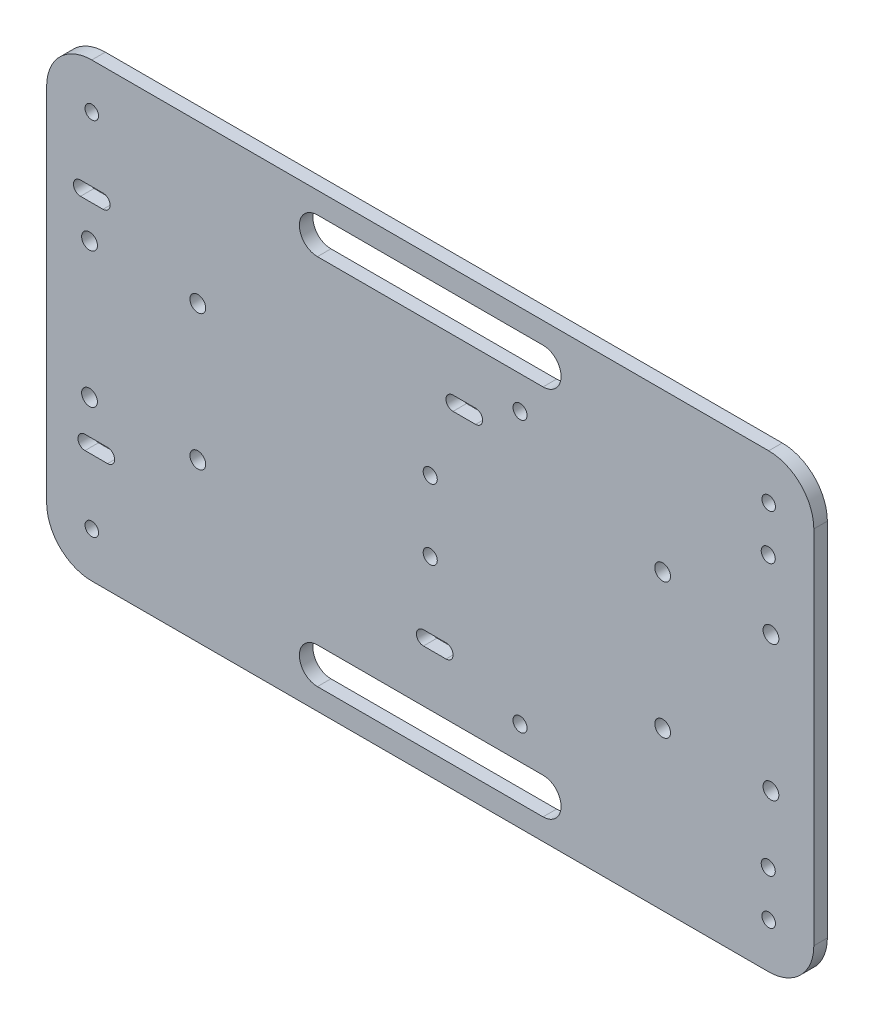
from build123d import *

# Parameters (mm, degrees)
SKETCH1_R           = 1.5
SKETCH1_R_2         = 1.75
SKETCH1_R_3         = 1.56
BOSS_EXTRUDE1_DEPTH = 3


with BuildPart() as part:
    # Sketch1 → Boss-Extrude1 (new body)
    with BuildSketch(Plane.XY):
        with BuildLine():
            Line((75, 50), (-75, 50))
            ThreePointArc((-75, 50), (-82.071067812, 47.071067812), (-85, 40))
            Line((-85, 40), (-85, -40))
            ThreePointArc((-85, -40), (-82.071067812, -47.071067812), (-75, -50))
            Line((-75, -50), (75, -50))
            ThreePointArc((75, -50), (82.071067812, -47.071067812), (85, -40))
            Line((85, -40), (85, -20))
            Line((85, -20), (85, 20))
            Line((85, 20), (85, 40))
            ThreePointArc((85, 40), (82.071067812, 47.071067812), (75, 50))
        make_face()
        with Locations((-75, -40)):
            Circle(SKETCH1_R, mode=Mode.SUBTRACT)
        with BuildLine():
            ThreePointArc((-71.5, -22.59), (-69.94, -24.15), (-71.5, -25.71))
            Line((-71.5, -25.71), (-74, -25.71))
            Line((-74, -25.71), (-76.5, -25.71))
            ThreePointArc((-76.5, -25.71), (-78.06, -24.15), (-76.5, -22.59))
            Line((-76.5, -22.59), (-74, -22.59))
            Line((-74, -22.59), (-71.5, -22.59))
        make_face(mode=Mode.SUBTRACT)
        with Locations((-75.5, -15)):
            Circle(SKETCH1_R_2, mode=Mode.SUBTRACT)
        with Locations((-51.5, -15)):
            Circle(SKETCH1_R_2, mode=Mode.SUBTRACT)
        with BuildLine():
            Line((25, -45.257829906), (-25, -45.257829906))
            ThreePointArc((-25, -45.257829906), (-29, -41.257829906), (-25, -37.257829906))
            Line((-25, -37.257829906), (25, -37.257829906))
            ThreePointArc((25, -37.257829906), (29, -41.257829906), (25, -45.257829906))
        make_face(mode=Mode.SUBTRACT)
        with Locations((19.9, -30)):
            Circle(SKETCH1_R_3, mode=Mode.SUBTRACT)
        with Locations((75, -40)):
            Circle(SKETCH1_R, mode=Mode.SUBTRACT)
        with Locations((74.9, -30)):
            Circle(SKETCH1_R_3, mode=Mode.SUBTRACT)
        with BuildLine():
            ThreePointArc((3.5, -22.59), (5.06, -24.15), (3.5, -25.71))
            Line((3.5, -25.71), (1, -25.71))
            Line((1, -25.71), (-1.5, -25.71))
            ThreePointArc((-1.5, -25.71), (-3.06, -24.15), (-1.5, -22.59))
            Line((-1.5, -22.59), (1, -22.59))
            Line((1, -22.59), (3.5, -22.59))
        make_face(mode=Mode.SUBTRACT)
        with Locations((0, -7.78)):
            Circle(SKETCH1_R_3, mode=Mode.SUBTRACT)
        with Locations((51.5, -15)):
            Circle(SKETCH1_R_2, mode=Mode.SUBTRACT)
        with Locations((75.5, -15)):
            Circle(SKETCH1_R_2, mode=Mode.SUBTRACT)
        with Locations((-75.5, 15)):
            Circle(SKETCH1_R_2, mode=Mode.SUBTRACT)
        with BuildLine():
            ThreePointArc((-72.5, 25.71), (-70.94, 24.15), (-72.5, 22.59))
            Line((-72.5, 22.59), (-75, 22.59))
            Line((-75, 22.59), (-77.5, 22.59))
            ThreePointArc((-77.5, 22.59), (-79.06, 24.15), (-77.5, 25.71))
            Line((-77.5, 25.71), (-75, 25.71))
            Line((-75, 25.71), (-72.5, 25.71))
        make_face(mode=Mode.SUBTRACT)
        with Locations((-51.5, 15)):
            Circle(SKETCH1_R_2, mode=Mode.SUBTRACT)
        with Locations((-75, 40)):
            Circle(SKETCH1_R, mode=Mode.SUBTRACT)
        with Locations((0, 7.78)):
            Circle(SKETCH1_R_3, mode=Mode.SUBTRACT)
        with BuildLine():
            ThreePointArc((10.05, 25.71), (11.61, 24.15), (10.05, 22.59))
            Line((10.05, 22.59), (7.55, 22.59))
            Line((7.55, 22.59), (5.05, 22.59))
            ThreePointArc((5.05, 22.59), (3.49, 24.15), (5.05, 25.71))
            Line((5.05, 25.71), (7.55, 25.71))
            Line((7.55, 25.71), (10.05, 25.71))
        make_face(mode=Mode.SUBTRACT)
        with Locations((51.5, 15)):
            Circle(SKETCH1_R_2, mode=Mode.SUBTRACT)
        with Locations((75.5, 15)):
            Circle(SKETCH1_R_2, mode=Mode.SUBTRACT)
        with Locations((19.9, 30)):
            Circle(SKETCH1_R_3, mode=Mode.SUBTRACT)
        with BuildLine():
            ThreePointArc((-25, 37.257829906), (-29, 41.257829906), (-25, 45.257829906))
            Line((-25, 45.257829906), (25, 45.257829906))
            ThreePointArc((25, 45.257829906), (29, 41.257829906), (25, 37.257829906))
            Line((25, 37.257829906), (-25, 37.257829906))
        make_face(mode=Mode.SUBTRACT)
        with Locations((74.9, 30)):
            Circle(SKETCH1_R_3, mode=Mode.SUBTRACT)
        with Locations((75, 40)):
            Circle(SKETCH1_R, mode=Mode.SUBTRACT)
    extrude(amount=BOSS_EXTRUDE1_DEPTH)


solid = part.part
